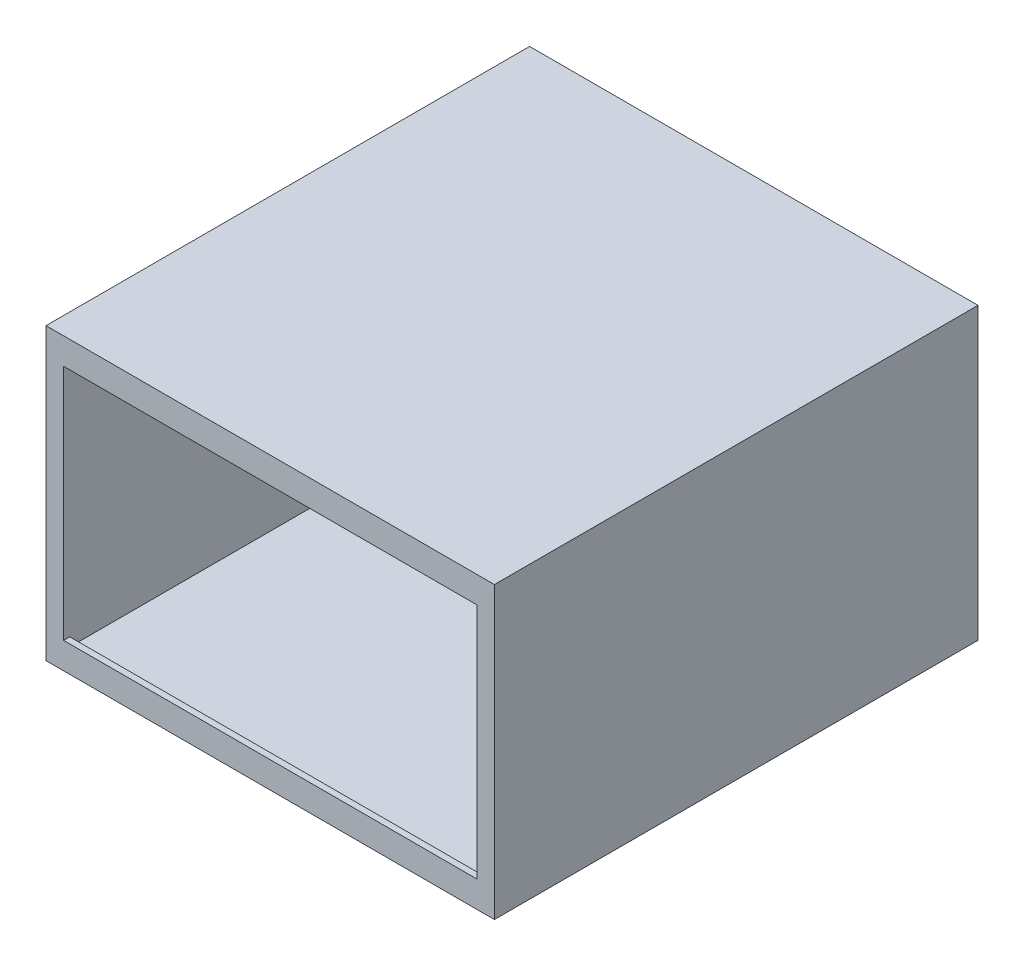
from build123d import *

# Parameters (mm, degrees)
SKETCH1_W           = 51
SKETCH1_H           = 33
SKETCH1_W_2         = 47
SKETCH1_H_2         = 29
BOSS_EXTRUDE1_DEPTH = 50
SKETCH1_3_W         = 51
SKETCH1_3_H         = 33
SKETCH1_3_R         = 4.5
BOSS_EXTRUDE2_DEPTH = 5
SKETCH2_W           = 51
SKETCH2_H           = 3
BOSS_EXTRUDE3_DEPTH = 0.7


with BuildPart() as part:
    # Sketch1 → Boss-Extrude1 (new body)
    with BuildSketch(Plane.XY):
        Rectangle(SKETCH1_W, SKETCH1_H)
        Rectangle(SKETCH1_W_2, SKETCH1_H_2, mode=Mode.SUBTRACT)
    extrude(amount=BOSS_EXTRUDE1_DEPTH)

    # Sketch1<3> → Boss-Extrude2 (add)
    with BuildSketch(Plane.XY):
        Rectangle(SKETCH1_3_W, SKETCH1_3_H)
        Circle(SKETCH1_3_R, mode=Mode.SUBTRACT)
    extrude(amount=-BOSS_EXTRUDE2_DEPTH)

    # Sketch2 → Boss-Extrude3 (add)
    with BuildSketch(Plane.XY.offset(50)):
        with Locations((0, 15)):
            Rectangle(SKETCH2_W, SKETCH2_H)
        with Locations((0, -15)):
            Rectangle(SKETCH2_W, SKETCH2_H)
    extrude(amount=-BOSS_EXTRUDE3_DEPTH)


solid = part.part
